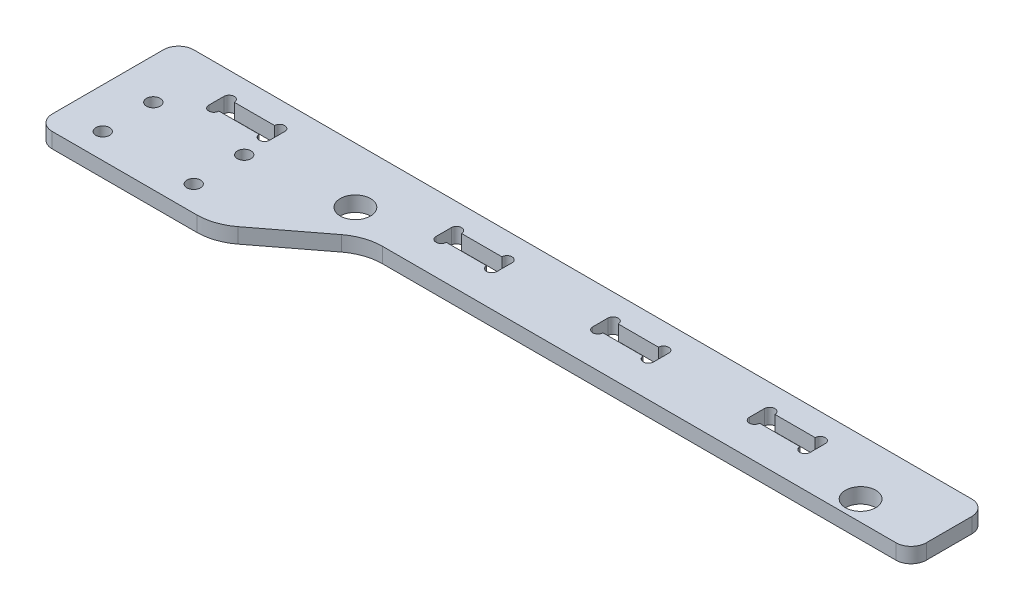
from build123d import *

# Parameters (mm, degrees)
SKETCH_1_W          = 160
SKETCH_1_H          = 15
EXTRUDE_1_DEPTH     = 3
EXTRUDE_2_DEPTH     = 3
SKETCH_3_W          = 12
SKETCH_3_H          = 3
CUT_EXTRUDE_1_DEPTH = 83.639276376
SKETCH_4_R          = 1
CUT_EXTRUDE_2_DEPTH = 83.639276376
CUT_EXTRUDE_4_DEPTH = 83.639276376
FILLET_1_R          = 3
FILLET_2_R          = 10
SKETCH_7_R          = 3
CUT_EXTRUDE_5_DEPTH = 83.639276376
SKETCH_8_R          = 1.35
CUT_EXTRUDE_6_DEPTH = 83.639276376


with BuildPart() as part:
    # 草图1 → 凸台-拉伸1 (new body)
    with BuildSketch(Plane(origin=(0, 0, 0), x_dir=(1, 0, 0), z_dir=(0, 1, 0))):
        Rectangle(SKETCH_1_W, SKETCH_1_H)
    extrude(amount=EXTRUDE_1_DEPTH)

    # 草图2 → 凸台-拉伸2 (add)
    with BuildSketch(Plane(origin=(0, 3, 0), x_dir=(1, 0, 0), z_dir=(0, 1, 0))):
        Polygon((-28, -7.5), (-80, -7.5), (-80, -20.5), (-45, -20.5), align=None)
    extrude(amount=-EXTRUDE_2_DEPTH)

    # 草图3 → 切除-拉伸1 (cut, through all)
    with BuildSketch(Plane.XZ):
        with Locations((16, -1)):
            Rectangle(SKETCH_3_W, SKETCH_3_H)
        with Locations((47, -1)):
            Rectangle(SKETCH_3_W, SKETCH_3_H)
        with Locations((-15, -1)):
            Rectangle(SKETCH_3_W, SKETCH_3_H)
        with Locations((-60, -1)):
            Rectangle(SKETCH_3_W, SKETCH_3_H)
    extrude(amount=-CUT_EXTRUDE_1_DEPTH, mode=Mode.SUBTRACT)

    # 草图4 → 切除-拉伸2 (cut, through all)
    with BuildSketch(Plane.XZ):
        with Locations((52, -2.5)):
            Circle(SKETCH_4_R)
        with Locations((42, -2.5)):
            Circle(SKETCH_4_R)
        with Locations((21, -2.5)):
            Circle(SKETCH_4_R)
        with Locations((11, -2.5)):
            Circle(SKETCH_4_R)
        with Locations((-10, -2.5)):
            Circle(SKETCH_4_R)
        with Locations((-20, -2.5)):
            Circle(SKETCH_4_R)
        with Locations((-65, -2.5)):
            Circle(SKETCH_4_R)
        with Locations((-55, -2.5)):
            Circle(SKETCH_4_R)
        with Locations((-55, 0.5)):
            Circle(SKETCH_4_R)
        with Locations((-65, 0.5)):
            Circle(SKETCH_4_R)
        with Locations((-20, 0.5)):
            Circle(SKETCH_4_R)
        with Locations((-10, 0.5)):
            Circle(SKETCH_4_R)
        with Locations((11, 0.5)):
            Circle(SKETCH_4_R)
        with Locations((21, 0.5)):
            Circle(SKETCH_4_R)
        with Locations((42, 0.5)):
            Circle(SKETCH_4_R)
        with Locations((52, 0.5)):
            Circle(SKETCH_4_R)
    extrude(amount=-CUT_EXTRUDE_2_DEPTH, mode=Mode.SUBTRACT)

    # 草图5 → 切除-拉伸4 (cut, through all)
    with BuildSketch(Plane.XZ):
        with BuildLine():
            Line((19.980196097, 0.52), (12.019803903, 0.52))
            ThreePointArc((12.019803903, 0.52), (10.989999519, 1.519950975), (9.98, 0.5))
            Line((9.98, 0.5), (9.98, -2.5))
            ThreePointArc((9.98, -2.5), (10.989999519, -3.519950975), (12.019803903, -2.52))
            Line((12.019803903, -2.52), (19.980196097, -2.52))
            ThreePointArc((19.980196097, -2.52), (21.010000481, -3.519950975), (22.02, -2.5))
            Line((22.02, -2.5), (22.02, 0.5))
            ThreePointArc((22.02, 0.5), (21.010000481, 1.519950975), (19.980196097, 0.52))
        make_face()
        with BuildLine():
            Line((53.02, -2.5), (53.02, 0.5))
            ThreePointArc((53.02, 0.5), (52.010000481, 1.519950975), (50.980196097, 0.52))
            Line((50.980196097, 0.52), (43.019803903, 0.52))
            ThreePointArc((43.019803903, 0.52), (41.989999519, 1.519950975), (40.98, 0.5))
            Line((40.98, 0.5), (40.98, -2.5))
            ThreePointArc((40.98, -2.5), (41.989999519, -3.519950975), (43.019803903, -2.52))
            Line((43.019803903, -2.52), (50.980196097, -2.52))
            ThreePointArc((50.980196097, -2.52), (52.010000481, -3.519950975), (53.02, -2.5))
        make_face()
        with BuildLine():
            Line((-11.019803903, 0.52), (-18.980196097, 0.52))
            ThreePointArc((-18.980196097, 0.52), (-20.010000481, 1.519950975), (-21.02, 0.5))
            Line((-21.02, 0.5), (-21.02, -2.5))
            ThreePointArc((-21.02, -2.5), (-20.010000481, -3.519950975), (-18.980196097, -2.52))
            Line((-18.980196097, -2.52), (-11.019803903, -2.52))
            ThreePointArc((-11.019803903, -2.52), (-9.989999519, -3.519950975), (-8.98, -2.5))
            Line((-8.98, -2.5), (-8.98, 0.5))
            ThreePointArc((-8.98, 0.5), (-9.989999519, 1.519950975), (-11.019803903, 0.52))
        make_face()
        with BuildLine():
            Line((-66.02, -2.5), (-66.02, 0.5))
            ThreePointArc((-66.02, 0.5), (-65.010000481, 1.519950975), (-63.980196097, 0.52))
            Line((-63.980196097, 0.52), (-56.019803903, 0.52))
            ThreePointArc((-56.019803903, 0.52), (-54.989999519, 1.519950975), (-53.98, 0.5))
            Line((-53.98, 0.5), (-53.98, -2.5))
            ThreePointArc((-53.98, -2.5), (-54.989999519, -3.519950975), (-56.019803903, -2.52))
            Line((-56.019803903, -2.52), (-63.980196097, -2.52))
            ThreePointArc((-63.980196097, -2.52), (-65.010000481, -3.519950975), (-66.02, -2.5))
        make_face()
    extrude(amount=-CUT_EXTRUDE_4_DEPTH, mode=Mode.SUBTRACT)

    # 圆角1
    fillet_1_edges = [part.edges().sort_by_distance(p)[0] for p in [
        (-80, 1.5, 20.5),
        (80, 1.5, 7.5),
        (-80, 1.5, -7.5),
        (80, 1.5, -7.5),
    ]]
    fillet(fillet_1_edges, radius=FILLET_1_R)

    # 圆角2
    fillet_2_edges = [part.edges().sort_by_distance(p)[0] for p in [
        (-28, 1.5, 7.5),
        (-45, 1.5, 20.5),
    ]]
    fillet(fillet_2_edges, radius=FILLET_2_R)

    # 草图7 → 切除-拉伸5 (cut, through all)
    with BuildSketch(Plane.XZ):
        with Locations(Location((66, 3.5, 0), (0, 0, 270))):
            Circle(SKETCH_7_R)
        with Locations(Location((-34, 3.5, 0), (0, 0, 270))):
            Circle(SKETCH_7_R)
    extrude(amount=-CUT_EXTRUDE_5_DEPTH, mode=Mode.SUBTRACT)

    # 草图8 → 切除-拉伸6 (cut, through all)
    with BuildSketch(Plane.XZ):
        with Locations(Location((-72, 5.5, 0), (0, 0, 270))):
            Circle(SKETCH_8_R)
        with Locations(Location((-72, 15.5, 0), (0, 0, 90))):
            Circle(SKETCH_8_R)
        with Locations(Location((-54, 15.5, 0), (0, 0, 270))):
            Circle(SKETCH_8_R)
        with Locations(Location((-54, 5.5, 0), (0, 0, 90))):
            Circle(SKETCH_8_R)
    extrude(amount=-CUT_EXTRUDE_6_DEPTH, mode=Mode.SUBTRACT)


solid = part.part
